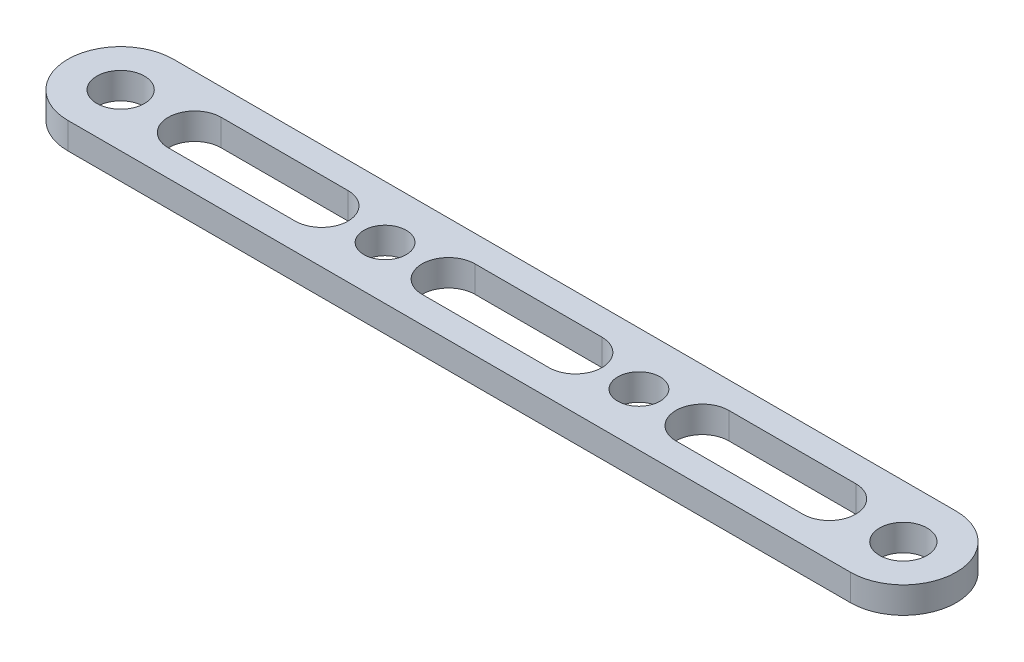
from build123d import *

# Parameters (mm, degrees)
SKETCH_1_R      = 4.5
SKETCH_1_R_2    = 4
EXTRUDE_1_DEPTH = 5


with BuildPart() as part:
    # 草图1 → 凸台-拉伸1 (new body)
    with BuildSketch(Plane(origin=(0, 0, 0), x_dir=(1, 0, 0), z_dir=(0, 1, 0))):
        with BuildLine():
            Line((-74, 10), (74, 10))
            ThreePointArc((74, 10), (84, 0), (74, -10))
            Line((74, -10), (-74, -10))
            ThreePointArc((-74, -10), (-84, 0), (-74, 10))
        make_face()
        with Locations(Location((74, 0, 0), (0, 0, 270))):
            Circle(SKETCH_1_R, mode=Mode.SUBTRACT)
        with Locations(Location((-74, 0, 0), (0, 0, 270))):
            Circle(SKETCH_1_R, mode=Mode.SUBTRACT)
        with Locations(Location((-24, 0, 0), (0, 0, 270))):
            Circle(SKETCH_1_R_2, mode=Mode.SUBTRACT)
        with Locations(Location((24, 0, 0), (0, 0, 90))):
            Circle(SKETCH_1_R_2, mode=Mode.SUBTRACT)
        with BuildLine():
            Line((-60, 5), (-36, 5))
            ThreePointArc((-36, 5), (-31, 0), (-36, -5))
            Line((-36, -5), (-60, -5))
            ThreePointArc((-60, -5), (-65, 0), (-60, 5))
        make_face(mode=Mode.SUBTRACT)
        with BuildLine():
            Line((-12, 5), (12, 5))
            ThreePointArc((12, 5), (17, 0), (12, -5))
            Line((12, -5), (-12, -5))
            ThreePointArc((-12, -5), (-17, 0), (-12, 5))
        make_face(mode=Mode.SUBTRACT)
        with BuildLine():
            Line((60, 5), (36, 5))
            ThreePointArc((36, 5), (31, 0), (36, -5))
            Line((36, -5), (60, -5))
            ThreePointArc((60, -5), (65, 0), (60, 5))
        make_face(mode=Mode.SUBTRACT)
    extrude(amount=EXTRUDE_1_DEPTH)


solid = part.part
